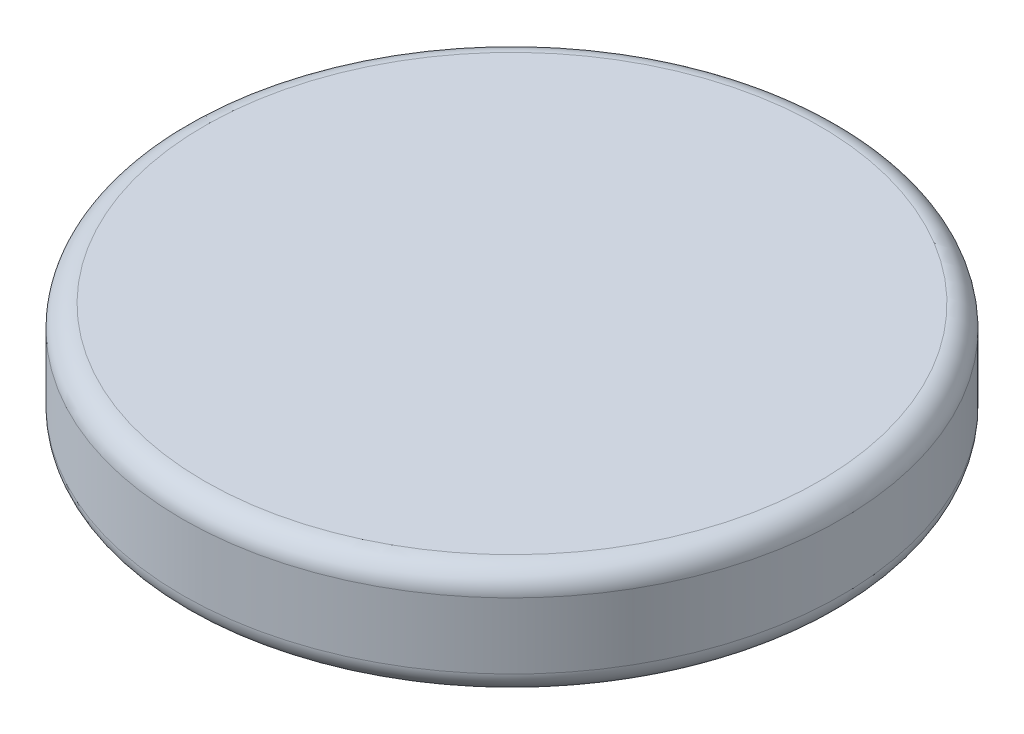
from build123d import *

# Parameters (mm, degrees)
SKETCH1_R           = 15
BOSS_EXTRUDE1_DEPTH = 5
FILLET1_R           = 1


with BuildPart() as part:
    # Sketch1 → Boss-Extrude1 (new body)
    with BuildSketch(Plane(origin=(0, 0, 0), x_dir=(1, 0, 0), z_dir=(0, 1, 0))):
        with Locations(Location((0, 0, 0), (0, 0, 270))):
            Circle(SKETCH1_R)
    extrude(amount=BOSS_EXTRUDE1_DEPTH)

    # Fillet1
    fillet1_edges = [part.edges().sort_by_distance(p)[0] for p in [
        (0, 0, -15),
        (0, 5, -15),
    ]]
    fillet(fillet1_edges, radius=FILLET1_R)


solid = part.part
